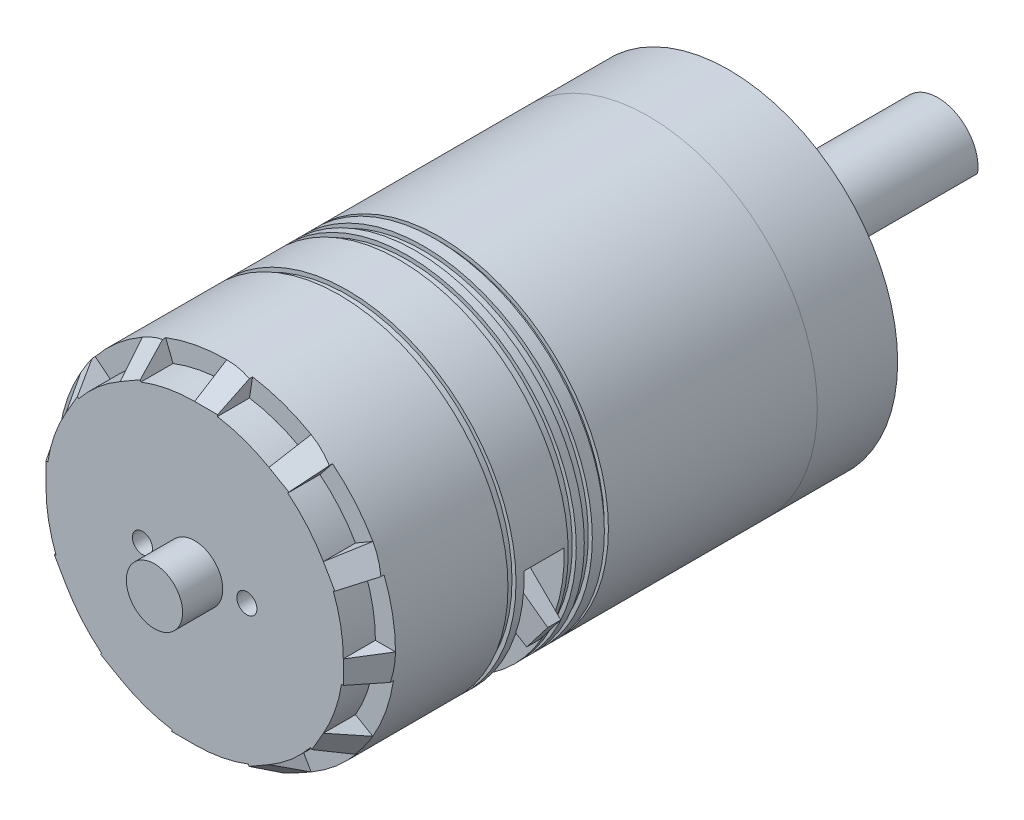
from build123d import *

# Parameters (mm, degrees)
SKETCH_1_R                           = 21
EXTRUDE_1_DEPTH                      = 66.5
SKETCH_2_R                           = 13
EXTRUDE_2_DEPTH                      = 2
SKETCH_3_R                           = 5
EXTRUDE_3_DEPTH                      = 24
CUT_EXTRUDE_1_DEPTH                  = 98.1506562
CUT_EXTRUDE_1_DEPTH_BACK             = 19.5
CHAMFER_1_SIZE                       = 0.5
PATTERN_CIRCULAR_1_COUNT             = 4
CHAMFER_1_OF_PATTERN_CIRCULAR_1_SIZE = 0.5
SKETCH_30_R                          = 3.5
EXTRUDE_4_DEPTH                      = 5
SKETCH_31_R                          = 8.25
EXTRUDE_5_DEPTH                      = 1
CUT_EXTRUDE_4_DEPTH                  = 5
CUT_EXTRUDE_START                    = -1
SKETCH_38_R                          = 21
SKETCH_38_R_2                        = 20.5
CUT_EXTRUDE_8_DEPTH                  = 1
EXTRUDE_8_DEPTH                      = 5
EXTRUDE_9_DEPTH                      = 5
SKETCH_37_W                          = 2.259014744
SKETCH_37_H                          = 4.906548019
EXTRUDE_10_DEPTH                     = 6
EXTRUDE_10_TAPER                     = 3
SKETCH_39_R                          = 21
SKETCH_39_R_2                        = 20.5
CUT_EXTRUDE_9_DEPTH                  = 0.5
SKETCH_41_R                          = 21
SKETCH_41_R_2                        = 20.5
CUT_EXTRUDE_10_DEPTH                 = 1
SKETCH_42_R                          = 21
SKETCH_42_R_2                        = 20.5
CUT_EXTRUDE_11_DEPTH                 = 1
CUT_EXTRUDE_12_REACH                 = 95.761
PATTERN_CIRCULAR_4_COUNT             = 12
CUT_EXTRUDE_13_REACH                 = 79.917
PATTERN_CIRCULAR_5_COUNT             = 12
HOLE_WIZARD_M3_1_D                   = 2.5
HOLE_WIZARD_M3_1_DEPTH               = 6
HOLE_WIZARD_M3_1_TIP                 = 0.751075774
SKETCH_13_R                          = 3
CUT_EXTRUDE_14_DEPTH                 = 3
CUT_EXTRUDE_15_DEPTH                 = 1


with BuildPart() as part:
    # 草图1 → 凸台-拉伸1 (new body)
    with BuildSketch(Plane.XY):
        Circle(SKETCH_1_R)
    extrude(amount=EXTRUDE_1_DEPTH)

    # 草图2 → 凸台-拉伸2 (add)
    with BuildSketch(Plane(origin=(0, 0, 0), x_dir=(-1, 0, 0), z_dir=(0, 0, -1))):
        with Locations(Location((0, 0, 0), (0, 0, 180))):
            Circle(SKETCH_2_R)
    extrude(amount=EXTRUDE_2_DEPTH)

    # 草图3 → 凸台-拉伸3 (add)
    with BuildSketch(Plane(origin=(0, 0, -2), x_dir=(-1, 0, 0), z_dir=(0, 0, -1))):
        Circle(SKETCH_3_R)
    extrude(amount=EXTRUDE_3_DEPTH)

    # 草图4 → 切除-拉伸1 (cut, two sides: drawn at the far end of the back side and taken through both)
    with BuildSketch(Plane(origin=(0, 0, -26), x_dir=(-1, 0, 0), z_dir=(0, 0, -1)).offset(-CUT_EXTRUDE_1_DEPTH_BACK)):
        Polygon((54.209292642, -59.866146891), (-0.707106781, -4.949747468), (-4.949747468, -0.707106781), (-59.866146891, 54.209292642), (-169.698945737, -55.623506204), (-55.623506204, -169.698945737), align=None)
    extrude(amount=CUT_EXTRUDE_1_DEPTH + CUT_EXTRUDE_1_DEPTH_BACK, mode=Mode.SUBTRACT)

    # 草图12 → #8-36 螺纹孔1 (revolve, cut)
    with BuildSketch(Plane(origin=(0, 17.5, 0), x_dir=(0, 1, 0), z_dir=(1, 0, 0))):
        Polygon((0, 0), (0, 11.6517212), (1.999999937, 10.45), (1.999999937, 0), align=None)
    hole_wizard_8_36_1 = revolve(axis=Axis((0, 17.5, -6.35), (0, 0, 1)), mode=Mode.SUBTRACT)

    # 倒角1
    chamfer_1_edges = [part.edges().sort_by_distance(p)[0] for p in [
        (0, 15.500000063, 0),
    ]]
    chamfer(chamfer_1_edges, length=CHAMFER_1_SIZE)

    # 阵列(圆周)1: #8-36 螺纹孔1 ×4 about axis
    pattern_circular_1_axis = Axis((0, 0, 0), (0, 0, 1))
    for i in range(1, PATTERN_CIRCULAR_1_COUNT):
        add(hole_wizard_8_36_1.rotate(pattern_circular_1_axis, i * 360 / PATTERN_CIRCULAR_1_COUNT), mode=Mode.SUBTRACT)

    # 倒角1 of 阵列(圆周)1
    chamfer_1_of_pattern_circular_1_edges = [part.edges().sort_by_distance(p)[0] for p in [
        (-15.500000063, 0, 0),
        (0, -15.500000063, 0),
        (15.500000063, 0, 0),
    ]]
    chamfer(chamfer_1_of_pattern_circular_1_edges, length=CHAMFER_1_OF_PATTERN_CIRCULAR_1_SIZE)

    # 草图30 → 凸台-拉伸4 (add)
    with BuildSketch(Plane.XY.offset(66.5)):
        Circle(SKETCH_30_R)
    extrude(amount=EXTRUDE_4_DEPTH)

    # 草图31 → 凸台-拉伸5 (add)
    with BuildSketch(Plane(origin=(0, 0, -2), x_dir=(-1, 0, 0), z_dir=(0, 0, -1))):
        Circle(SKETCH_31_R)
    extrude(amount=EXTRUDE_5_DEPTH)

    # Sketch 3D_5 → 切除-拉伸4 (cut)
    with BuildSketch(Plane(origin=(21.698598574, 0, 41.5), x_dir=(-0.8701153178040487, -0.49284818526881014, 0), z_dir=(0, 0, -1))):
        with BuildLine():
            Line((0, 0), (2.265924322, 8.186168064))
            Line((2.265924322, 8.186168064), (31.840322246, 0))
            Line((31.840322246, 0), (29.574397924, -8.186168064))
            ThreePointArc((29.574397924, -8.186168064), (13.091788044, -10.218142392), (0, 0))
        make_face()
    extrude(amount=-CUT_EXTRUDE_4_DEPTH, mode=Mode.SUBTRACT)

    # 草图38 → 切除-拉伸8 (cut)
    with BuildSketch(Plane.XY.offset(48.5).offset(CUT_EXTRUDE_START)):
        Circle(SKETCH_38_R)
        Circle(SKETCH_38_R_2, mode=Mode.SUBTRACT)
    extrude(amount=CUT_EXTRUDE_8_DEPTH, mode=Mode.SUBTRACT)

    # 草图35 → 凸台-拉伸8 (add)
    with BuildSketch(Plane(origin=(0, 0, 46.5), x_dir=(-1, 0, 0), z_dir=(0, 0, -1))):
        Polygon((-19.650844704, 0.722539425), (-13.558326759, -7.216544928), (-10.385037772, -4.781337133), (-16.604585732, 3.323278452), (-19.650844704, 0.985554524), align=None)
    extrude(amount=EXTRUDE_8_DEPTH)

    # 草图36 → 凸台-拉伸9 (add)
    with BuildSketch(Plane(origin=(0, 0, 46.5), x_dir=(-1, 0, 0), z_dir=(0, 0, -1))):
        Polygon((0, -18.923068099), (-7.58749284, -12.409240314), (-4.981961726, -9.374243178), (2.605531114, -15.888070963), align=None)
    extrude(amount=EXTRUDE_9_DEPTH)

    # 草图37 → 凸台-拉伸10 (add)
    with BuildSketch(Plane(origin=(12.018490008, -9.223087045, 0), x_dir=(0, 0, -1), z_dir=(0.793322246809358, -0.6088019486806462, 0))):
        with Locations((-44.496547362, 7.679113422)):
            Rectangle(SKETCH_37_W, SKETCH_37_H)
    extrude(amount=EXTRUDE_10_DEPTH, taper=EXTRUDE_10_TAPER)

    # 草图39 → 切除-拉伸9 (cut)
    with BuildSketch(Plane(origin=(0, 0, 36), x_dir=(-1, 0, 0), z_dir=(0, 0, -1))):
        Circle(SKETCH_39_R)
        with Locations(Location((0, 0, 0), (0, 0, 180))):
            Circle(SKETCH_39_R_2, mode=Mode.SUBTRACT)
    extrude(amount=-CUT_EXTRUDE_9_DEPTH, mode=Mode.SUBTRACT)

    # 草图41 → 切除-拉伸10 (cut)
    with BuildSketch(Plane(origin=(0, 0, 38), x_dir=(-1, 0, 0), z_dir=(0, 0, -1))):
        Circle(SKETCH_41_R)
        Circle(SKETCH_41_R_2, mode=Mode.SUBTRACT)
    extrude(amount=-CUT_EXTRUDE_10_DEPTH, mode=Mode.SUBTRACT)

    # 草图42 → 切除-拉伸11 (cut)
    with BuildSketch(Plane(origin=(0, 0, 40), x_dir=(-1, 0, 0), z_dir=(0, 0, -1))):
        Circle(SKETCH_42_R)
        Circle(SKETCH_42_R_2, mode=Mode.SUBTRACT)
    extrude(amount=-CUT_EXTRUDE_11_DEPTH, mode=Mode.SUBTRACT)

    # 草图43 → 切除-拉伸12 (cut, up to next)
    with BuildSketch(Plane.XY.offset(62.5), mode=Mode.PRIVATE) as cut_extrude_12_sk1:
        with BuildLine():
            Line((0, 18.5), (0, 21))
            ThreePointArc((0, 21), (-3.864852633, 20.641291484), (-7.597671404, 19.577420393))
            Line((-7.597671404, 19.577420393), (-6.693186713, 17.246775108))
            ThreePointArc((-6.693186713, 17.246775108), (-3.404751129, 18.183994879), (0, 18.5))
        make_face()
    cut_extrude_12_tool1 = extrude(cut_extrude_12_sk1.sketch, amount=CUT_EXTRUDE_12_REACH, mode=Mode.PRIVATE) & part.part
    cut_extrude_12 = cut_extrude_12_tool1.solids().sort_by_distance((-3.618908, 19.327758, 62.5))[0]
    add(cut_extrude_12, mode=Mode.SUBTRACT)

    # 阵列(圆周)4: 切除-拉伸12 ×12 about axis
    pattern_circular_4_axis = Axis((0, 0, 0), (0, 0, 1))
    for i in range(1, PATTERN_CIRCULAR_4_COUNT):
        add(cut_extrude_12.rotate(pattern_circular_4_axis, i * 360 / PATTERN_CIRCULAR_4_COUNT), mode=Mode.SUBTRACT)

    # 切除-拉伸13: up to this plane
    cut_extrude_13_end = Plane(origin=(-6.693186713, 17.246775108, 71.501), z_dir=(0.9322581139355903, 0.36179387640099137, 0))
    # 草图45 → 切除-拉伸13 (cut, up to the surface)
    with BuildSketch(Plane(origin=(0, 0, 0), x_dir=(0, 0, 1), z_dir=(-0.8660254037844382, -0.5000000000000011, 0)), mode=Mode.PRIVATE) as cut_extrude_13_sk1:
        Polygon((62.5, 21), (66.5, 18.5), (66.5, 21), align=None)
    cut_extrude_13_tool1 = split(extrude(cut_extrude_13_sk1.sketch, amount=-CUT_EXTRUDE_13_REACH, mode=Mode.PRIVATE), bisect_by=cut_extrude_13_end, keep=Keep.BOTH, mode=Mode.PRIVATE)
    cut_extrude_13 = cut_extrude_13_tool1.solids().sort_by_distance((-10.083333, 17.464846, 65.166667))[0]
    add(cut_extrude_13, mode=Mode.SUBTRACT)

    # 阵列(圆周)5: 切除-拉伸13 ×12 about axis
    pattern_circular_5_axis = Axis((0, 0, 0), (0, 0, 1))
    for i in range(1, PATTERN_CIRCULAR_5_COUNT):
        add(cut_extrude_13.rotate(pattern_circular_5_axis, i * 360 / PATTERN_CIRCULAR_5_COUNT), mode=Mode.SUBTRACT)

    # M3 螺纹孔1
    with Locations(Plane.XY.offset(66.5)):
        with Locations((-6.5, 0), (6.5, 0)):
            Hole(HOLE_WIZARD_M3_1_D / 2, depth=HOLE_WIZARD_M3_1_DEPTH)
            with Locations((0, 0, -(HOLE_WIZARD_M3_1_DEPTH + HOLE_WIZARD_M3_1_TIP / 2))):  # 118° drill point
                Cone(0, HOLE_WIZARD_M3_1_D / 2, HOLE_WIZARD_M3_1_TIP, mode=Mode.SUBTRACT)

    # 草图13 → 切除-拉伸14 (cut)
    with BuildSketch(Plane(origin=(0, 0, 0), x_dir=(-1, 0, 0), z_dir=(0, 0, -1))):
        with Locations((12.374368671, -12.374368671)):
            Circle(SKETCH_13_R)
        with Locations(Location((12.374368671, 12.374368671, 0), (0, 0, 180))):
            Circle(SKETCH_13_R)
        with Locations(Location((-12.374368671, -12.374368671, 0), (0, 0, 180))):
            Circle(SKETCH_13_R)
        with Locations((-12.374368671, 12.374368671)):
            Circle(SKETCH_13_R)
    extrude(amount=-CUT_EXTRUDE_14_DEPTH, mode=Mode.SUBTRACT)

    # 草图52 → 切除-拉伸15 (cut)
    with BuildSketch(Plane(origin=(0, 0, 3), x_dir=(-1, 0, 0), z_dir=(0, 0, -1))):
        Polygon((13.817744344, 12.374368671), (13.096056507, 13.624368671), (11.652680834, 13.624368671), (10.930992998, 12.374368671), (11.652680834, 11.124368671), (13.096056507, 11.124368671), align=None)
        Polygon((-13.096056507, 11.124368671), (-13.817744344, 12.374368671), (-13.096056507, 13.624368671), (-11.652680834, 13.624368671), (-10.930992998, 12.374368671), (-11.652680834, 11.124368671), align=None)
        Polygon((-13.817744344, -12.374368671), (-13.096056507, -13.624368671), (-11.652680834, -13.624368671), (-10.930992998, -12.374368671), (-11.652680834, -11.124368671), (-13.096056507, -11.124368671), align=None)
        Polygon((13.096056507, -11.124368671), (13.817744344, -12.374368671), (13.096056507, -13.624368671), (11.652680834, -13.624368671), (10.930992998, -12.374368671), (11.652680834, -11.124368671), align=None)
    extrude(amount=-CUT_EXTRUDE_15_DEPTH, mode=Mode.SUBTRACT)


solid = part.part
